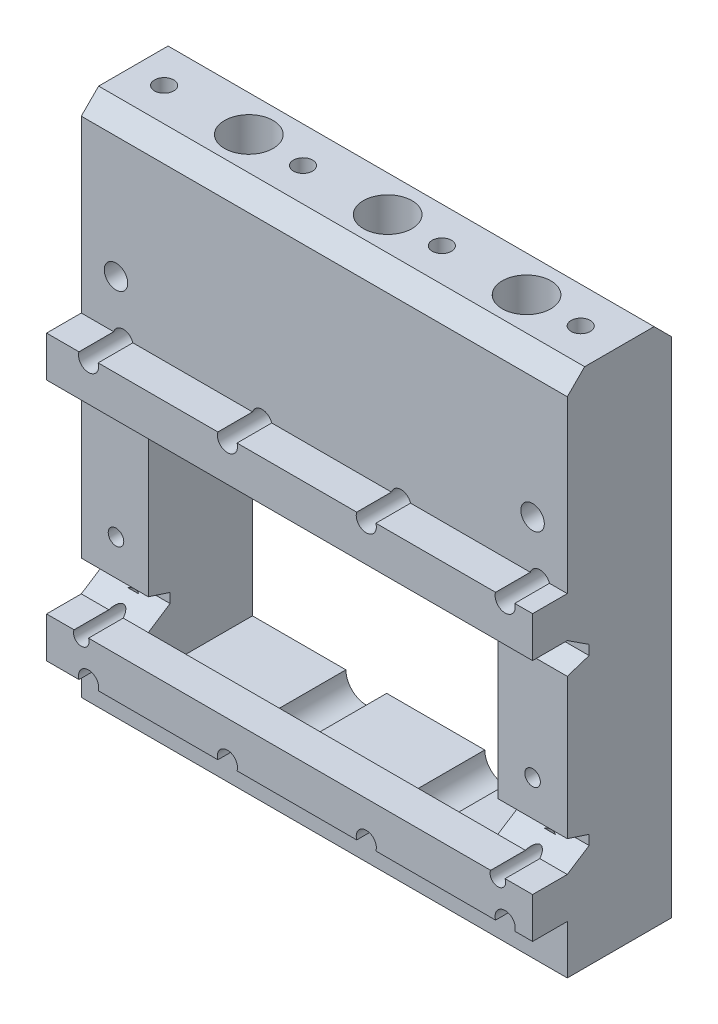
from build123d import *

# Parameters (mm, degrees)
SKETCH1_W            = 140
SKETCH1_H            = 150
SKETCH1_W_2          = 100.689655172
SKETCH1_H_2          = 60
BOSS_EXTRUDE1_DEPTH  = 30
CUT_EXTRUDE1_DEPTH   = 300
SKETCH11_W           = 140
SKETCH11_H           = 11.715455608
BOSS_EXTRUDE2_DEPTH  = 10
SKETCH3_R            = 3
CUT_EXTRUDE2_DEPTH   = 100
SKETCH4_R            = 7
CUT_EXTRUDE3_DEPTH   = 70
LPATTERN1_COUNT      = 3
LPATTERN1_PITCH      = 40
SKETCH5_R            = 2.238650571
CUT_EXTRUDE4_DEPTH   = 100
SKETCH6_R            = 4.368973
CUT_EXTRUDE5_DEPTH   = 25
LPATTERN2_COUNT      = 2
LPATTERN2_PITCH      = 20
LPATTERN2_COUNT_DIR2 = 2
LPATTERN2_PITCH_DIR2 = 120
SKETCH7_R            = 2.900161541
CUT_EXTRUDE6_DEPTH   = 40
SKETCH8_R            = 5.870976625
CUT_EXTRUDE7_DEPTH   = 25
LPATTERN3_COUNT      = 4
LPATTERN3_PITCH      = 40
LPATTERN3_COUNT_DIR2 = 2
LPATTERN3_PITCH_DIR2 = 80
SKETCH9_R            = 3.381759822
CUT_EXTRUDE8_DEPTH   = 100
CUT_EXTRUDE9_START   = -10
SKETCH10_R           = 6.982534733
CUT_EXTRUDE9_DEPTH   = 20
LPATTERN4_COUNT      = 2
LPATTERN4_PITCH      = 120
CHAMFER1_SIZE        = 5
SKETCH16_W           = 13.0342626
SKETCH16_H           = 10.99288792
CUT_EXTRUDE13_DEPTH  = 20
SKETCH17_R           = 2.765660559
CUT_EXTRUDE14_DEPTH  = 15
LPATTERN6_COUNT      = 4
LPATTERN6_PITCH      = 40


with BuildPart() as part:
    # Sketch1 → Boss-Extrude1 (new body)
    with BuildSketch(Plane.XY):
        with Locations((6.896551724, 31.293103448)):
            Rectangle(SKETCH1_W, SKETCH1_H)
        with Locations((6.551724138, 1.293103448)):
            Rectangle(SKETCH1_W_2, SKETCH1_H_2, mode=Mode.SUBTRACT)
    extrude(amount=BOSS_EXTRUDE1_DEPTH)

    # Sketch2 → Cut-Extrude1 (cut)
    with BuildSketch(Plane.ZY.offset(63.103448276)):
        Polygon((30, 40.467146905), (23.720048633, 36.378281812), (23.720048633, 33.58866414), (30, 31.544440585), align=None)
    cut_extrude1 = extrude(amount=-CUT_EXTRUDE1_DEPTH, mode=Mode.SUBTRACT)

    # Sketch11 → Boss-Extrude2 (add)
    with BuildSketch(Plane.XY.offset(30)):
        with Locations((6.896551724, 46.324874709)):
            Rectangle(SKETCH11_W, SKETCH11_H)
    boss_extrude2 = extrude(amount=BOSS_EXTRUDE2_DEPTH)

    # Mirror1: Cut-Extrude1, Boss-Extrude2 across plane
    add(cut_extrude1.mirror(Plane(origin=(0, 11.293103448, 0), x_dir=(0, 0, 1), z_dir=(0, -1, 0))), mode=Mode.SUBTRACT)
    add(boss_extrude2.mirror(Plane(origin=(0, 11.293103448, 0), x_dir=(0, 0, 1), z_dir=(0, -1, 0))))

    # Sketch3 → Cut-Extrude2 (cut)
    with BuildSketch(Plane(origin=(0, 106.293103448, 0), x_dir=(1, 0, 0), z_dir=(0, 1, 0))):
        with Locations(Location((-29.404551137, -15.436210525, 0), (0, 0, 270))):
            Circle(SKETCH3_R)
    cut_extrude2 = extrude(amount=-CUT_EXTRUDE2_DEPTH, mode=Mode.SUBTRACT)

    # Sketch4 → Cut-Extrude3 (cut)
    with BuildSketch(Plane(origin=(0, 106.293103448, 0), x_dir=(1, 0, 0), z_dir=(0, 1, 0))):
        with Locations(Location((-29.404551137, -15.436210525, 0), (0, 0, 270))):
            Circle(SKETCH4_R)
    cut_extrude3 = extrude(amount=-CUT_EXTRUDE3_DEPTH, mode=Mode.SUBTRACT)

    # LPattern1: Cut-Extrude2, Cut-Extrude3 ×3
    with Locations(*[(i * LPATTERN1_PITCH, 0, 0) for i in range(1, LPATTERN1_COUNT)]):
        add(cut_extrude2, mode=Mode.SUBTRACT)
        add(cut_extrude3, mode=Mode.SUBTRACT)

    # Sketch5 → Cut-Extrude4 (cut)
    with BuildSketch(Plane(origin=(0, 0, 0), x_dir=(-1, 0, 0), z_dir=(0, 0, -1))):
        with Locations((53.103448276, -18.706896552)):
            Circle(SKETCH5_R)
    cut_extrude4 = extrude(amount=-CUT_EXTRUDE4_DEPTH, mode=Mode.SUBTRACT)

    # Sketch6 → Cut-Extrude5 (cut)
    with BuildSketch(Plane(origin=(0, 0, 0), x_dir=(-1, 0, 0), z_dir=(0, 0, -1))):
        with Locations((53.103448276, -18.706896552)):
            Circle(SKETCH6_R)
    cut_extrude5 = extrude(amount=-CUT_EXTRUDE5_DEPTH, mode=Mode.SUBTRACT)

    # LPattern2: Cut-Extrude4, Cut-Extrude5 2 × 2
    with Locations(*[(j * LPATTERN2_PITCH_DIR2, i * LPATTERN2_PITCH, 0) for i in range(LPATTERN2_COUNT) for j in range(LPATTERN2_COUNT_DIR2) if (i, j) != (0, 0)]):
        add(cut_extrude4, mode=Mode.SUBTRACT)
        add(cut_extrude5, mode=Mode.SUBTRACT)

    # Sketch7 → Cut-Extrude6 (cut)
    with BuildSketch(Plane(origin=(0, 0, 0), x_dir=(-1, 0, 0), z_dir=(0, 0, -1))):
        with Locations((51.00310189, 51.293103448)):
            Circle(SKETCH7_R)
    cut_extrude6 = extrude(amount=-CUT_EXTRUDE6_DEPTH, mode=Mode.SUBTRACT)

    # Sketch8 → Cut-Extrude7 (cut)
    with BuildSketch(Plane(origin=(0, 0, 0), x_dir=(-1, 0, 0), z_dir=(0, 0, -1))):
        with Locations((51.00310189, 51.293103448)):
            Circle(SKETCH8_R)
    cut_extrude7 = extrude(amount=-CUT_EXTRUDE7_DEPTH, mode=Mode.SUBTRACT)

    # LPattern3: Cut-Extrude6, Cut-Extrude7 4 × 2
    with Locations(*[(i * LPATTERN3_PITCH, -j * LPATTERN3_PITCH_DIR2, 0) for i in range(LPATTERN3_COUNT) for j in range(LPATTERN3_COUNT_DIR2) if (i, j) != (0, 0)]):
        add(cut_extrude6, mode=Mode.SUBTRACT)
        add(cut_extrude7, mode=Mode.SUBTRACT)

    # Sketch9 → Cut-Extrude8 (cut)
    with BuildSketch(Plane(origin=(0, 0, 0), x_dir=(-1, 0, 0), z_dir=(0, 0, -1))):
        with Locations((-66.896551724, 66.293103448)):
            Circle(SKETCH9_R)
    cut_extrude8 = extrude(amount=-CUT_EXTRUDE8_DEPTH, mode=Mode.SUBTRACT)

    # Sketch10 → Cut-Extrude9 (cut)
    with BuildSketch(Plane.XY.offset(30).offset(CUT_EXTRUDE9_START)):
        with Locations((66.896551724, 66.293103448)):
            Circle(SKETCH10_R)
    cut_extrude9 = extrude(amount=-CUT_EXTRUDE9_DEPTH, mode=Mode.SUBTRACT)

    # LPattern4: Cut-Extrude8, Cut-Extrude9 ×2
    with Locations(*[(-i * LPATTERN4_PITCH, 0, 0) for i in range(1, LPATTERN4_COUNT)]):
        add(cut_extrude8, mode=Mode.SUBTRACT)
        add(cut_extrude9, mode=Mode.SUBTRACT)

    # Chamfer1
    chamfer1_edges = [part.edges().sort_by_distance(p)[0] for p in [
        (6.896551724, 106.293103448, 30),
        (6.896551724, 106.293103448, 0),
    ]]
    chamfer(chamfer1_edges, length=CHAMFER1_SIZE)

    # Sketch16 → Cut-Extrude13 (cut)
    with BuildSketch(Plane(origin=(0, 0, 0), x_dir=(-1, 0, 0), z_dir=(0, 0, -1))):
        with Locations((-66.003847549, 93.127101144)):
            Rectangle(SKETCH16_W, SKETCH16_H)
    cut_extrude13 = extrude(amount=-CUT_EXTRUDE13_DEPTH, mode=Mode.SUBTRACT)

    # Sketch17 → Cut-Extrude14 (cut)
    with BuildSketch(Plane(origin=(0, 106.293103448, 0), x_dir=(1, 0, 0), z_dir=(0, 1, 0))):
        with Locations(Location((66.162561207, -15.398222954, 0), (0, 0, 270))):
            Circle(SKETCH17_R)
    cut_extrude14 = extrude(amount=-CUT_EXTRUDE14_DEPTH, mode=Mode.SUBTRACT)

    # LPattern6: Cut-Extrude13, Cut-Extrude14 ×4
    with Locations(*[(-i * LPATTERN6_PITCH, 0, 0) for i in range(1, LPATTERN6_COUNT)]):
        add(cut_extrude13, mode=Mode.SUBTRACT)
        add(cut_extrude14, mode=Mode.SUBTRACT)


solid = part.part
